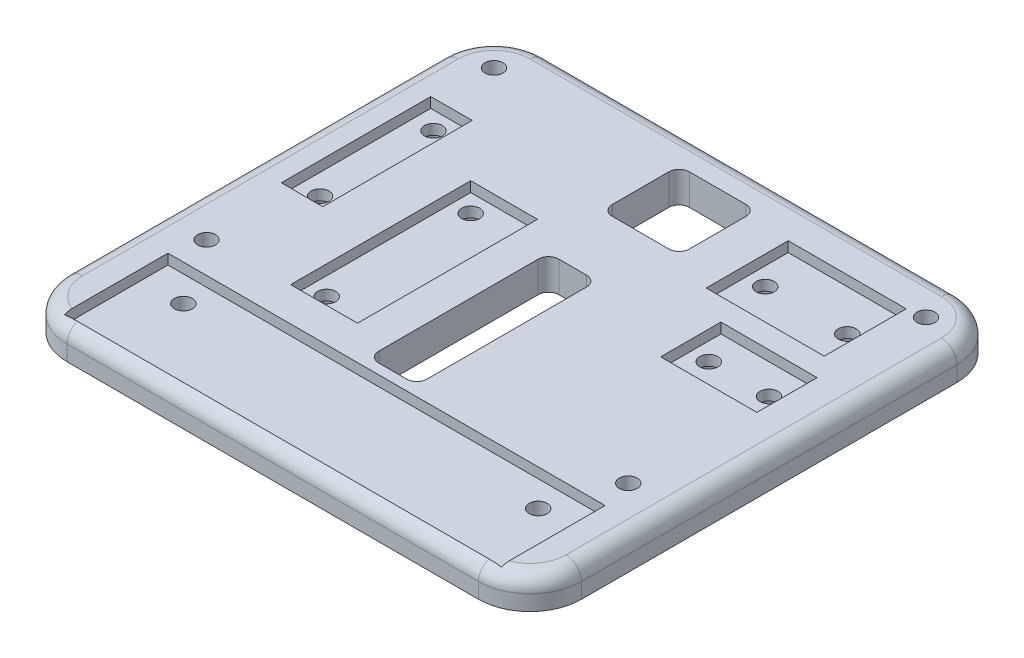
from build123d import *

# Parameters (mm, degrees)
ESBO_O1_W                          = 100
ESBO_O1_H                          = 93
RESSALTO_EXTRUS_O1_DEPTH           = 6
FILETE1_R                          = 10
FILETE2_R                          = 3
ESBO_O2_W                          = 85
ESBO_O2_H                          = 20.1
CORTE_EXTRUS_O1_DEPTH              = 2
CORTE_EXTRUS_O6_REACH              = 70.398
ESBO_O8_R                          = 1.75
ESBO_O5_W                          = 8.05
ESBO_O5_H                          = 29.05
CORTE_EXTRUS_O3_DEPTH              = 2
CORTE_EXTRUS_O10_REACH             = 70.398
ESBO_O13_R                         = 1.75
ESBO_O14_R                         = 3.25
CORTE_EXTRUS_O11_DEPTH             = 2
ESBO_O6_W                          = 22.94
ESBO_O6_H                          = 15.94
CORTE_EXTRUS_O4_DEPTH              = 2
CORTE_EXTRUS_O12_REACH             = 70.398
ESBO_O15_R                         = 1.75
ESBO_O16_R                         = 3.25
CORTE_EXTRUS_O13_DEPTH             = 2
ESBO_O7_W                          = 18.71
ESBO_O7_H                          = 11.71
CORTE_EXTRUS_O5_DEPTH              = 2
CORTE_EXTRUS_O8_REACH              = 70.398
ESBO_O11_R                         = 1.75
ESBO_O12_R                         = 3.25
CORTE_EXTRUS_O9_DEPTH              = 2
ESBO_O17_W                         = 13
ESBO_O17_H                         = 35
CORTE_EXTRUS_O14_DEPTH             = 2
CORTE_EXTRUS_O15_REACH             = 70.398
ESBO_O18_R                         = 1.75
CORTE_EXTRUS_O15_DIRECTION_2_DEPTH = 69.397734022
ESBO_O19_R                         = 3.25
CORTE_EXTRUS_O18_DEPTH             = 2
CORTE_EXTRUS_O17_REACH             = 70.544
ESBO_O20_W                         = 9.4
ESBO_O20_H                         = 35
CORTE_EXTRUS_O19_REACH             = 70.544
ESBO_O21_W                         = 15
ESBO_O21_H                         = 15
FILETE3_R                          = 2
CORTE_EXTRUS_O20_REACH             = 70.544
ESBO_O22_R                         = 1.75
CORTE_EXTRUS_O21_REACH             = 70.544
ESBO_O23_R                         = 1.75


with BuildPart() as part:
    # Esboço1 → Ressalto-extrusão1 (new body)
    with BuildSketch(Plane(origin=(0, 0, 0), x_dir=(1, 0, 0), z_dir=(0, 1, 0))):
        Rectangle(ESBO_O1_W, ESBO_O1_H)
    extrude(amount=RESSALTO_EXTRUS_O1_DEPTH)

    # Filete1
    filete1_edges = [part.edges().sort_by_distance(p)[0] for p in [
        (50, 3, 46.5),
        (-50, 3, 46.5),
        (-50, 3, -46.5),
        (50, 3, -46.5),
    ]]
    fillet(filete1_edges, radius=FILETE1_R)

    # Filete2
    filete2_edges = [part.edges().sort_by_distance(p)[0] for p in [
        (0, 6, -46.5),
        (50, 6, 0),
        (-50, 6, 0),
        (0, 6, 46.5),
        (-47.071067812, 6, -43.571067812),
        (-47.071067812, 6, 43.571067812),
        (47.071067812, 6, 43.571067812),
        (47.071067812, 6, -43.571067812),
    ]]
    fillet(filete2_edges, radius=FILETE2_R)

    # Esboço2 → Corte-extrusão1 (cut)
    with BuildSketch(Plane(origin=(0, 6, 0), x_dir=(1, 0, 0), z_dir=(0, 1, 0))):
        with Locations((0, -34.45)):
            Rectangle(ESBO_O2_W, ESBO_O2_H)
    extrude(amount=-CORTE_EXTRUS_O1_DEPTH, mode=Mode.SUBTRACT)

    # Esboço8 → Corte-extrusão6 (cut, up to next)
    with BuildSketch(Plane(origin=(0, 4, 0), x_dir=(1, 0, 0), z_dir=(0, 1, 0)), mode=Mode.PRIVATE) as corte_extrus_o6_sk1:
        with Locations(Location((34.5, -29.4, 0), (0, 0, 270))):
            Circle(ESBO_O8_R)
    corte_extrus_o6_tool1 = extrude(corte_extrus_o6_sk1.sketch, amount=-CORTE_EXTRUS_O6_REACH, mode=Mode.PRIVATE) & part.part
    # Esboço8 → Corte-extrusão6 (cut, up to next)
    with BuildSketch(Plane(origin=(0, 4, 0), x_dir=(1, 0, 0), z_dir=(0, 1, 0)), mode=Mode.PRIVATE) as corte_extrus_o6_sk2:
        with Locations(Location((-34.5, -29.4, 0), (0, 0, 270))):
            Circle(ESBO_O8_R)
    corte_extrus_o6_tool2 = extrude(corte_extrus_o6_sk2.sketch, amount=-CORTE_EXTRUS_O6_REACH, mode=Mode.PRIVATE) & part.part
    add(corte_extrus_o6_tool1.solids().sort_by_distance((34.5, 4, 29.4))[0], mode=Mode.SUBTRACT)
    add(corte_extrus_o6_tool2.solids().sort_by_distance((-34.5, 4, 29.4))[0], mode=Mode.SUBTRACT)

    # Esboço5 → Corte-extrusão3 (cut)
    with BuildSketch(Plane(origin=(0, 6, 0), x_dir=(1, 0, 0), z_dir=(0, 1, 0))):
        with Locations((-39.3, 13)):
            Rectangle(ESBO_O5_W, ESBO_O5_H)
    extrude(amount=-CORTE_EXTRUS_O3_DEPTH, mode=Mode.SUBTRACT)

    # Esboço13 → Corte-extrusão10 (cut, up to next)
    with BuildSketch(Plane(origin=(0, 4, 0), x_dir=(1, 0, 0), z_dir=(0, 1, 0)), mode=Mode.PRIVATE) as corte_extrus_o10_sk1:
        with Locations(Location((-39.3, 24.025, 0), (0, 0, 270))):
            Circle(ESBO_O13_R)
    corte_extrus_o10_tool1 = extrude(corte_extrus_o10_sk1.sketch, amount=-CORTE_EXTRUS_O10_REACH, mode=Mode.PRIVATE) & part.part
    # Esboço13 → Corte-extrusão10 (cut, up to next)
    with BuildSketch(Plane(origin=(0, 4, 0), x_dir=(1, 0, 0), z_dir=(0, 1, 0)), mode=Mode.PRIVATE) as corte_extrus_o10_sk2:
        with Locations(Location((-39.3, 1.975, 0), (0, 0, 270))):
            Circle(ESBO_O13_R)
    corte_extrus_o10_tool2 = extrude(corte_extrus_o10_sk2.sketch, amount=-CORTE_EXTRUS_O10_REACH, mode=Mode.PRIVATE) & part.part
    add(corte_extrus_o10_tool1.solids().sort_by_distance((-39.3, 4, -24.025))[0], mode=Mode.SUBTRACT)
    add(corte_extrus_o10_tool2.solids().sort_by_distance((-39.3, 4, -1.975))[0], mode=Mode.SUBTRACT)

    # Esboço14 → Corte-extrusão11 (cut)
    with BuildSketch(Plane.XZ):
        with Locations(Location((-39.3, -1.975, 0), (0, 0, 270))):
            Circle(ESBO_O14_R)
        with Locations(Location((-39.3, -24.025, 0), (0, 0, 270))):
            Circle(ESBO_O14_R)
    extrude(amount=-CORTE_EXTRUS_O11_DEPTH, mode=Mode.SUBTRACT)

    # Esboço6 → Corte-extrusão4 (cut)
    with BuildSketch(Plane(origin=(0, 6, 0), x_dir=(1, 0, 0), z_dir=(0, 1, 0))):
        with Locations((27.18, 30.03)):
            Rectangle(ESBO_O6_W, ESBO_O6_H)
    extrude(amount=-CORTE_EXTRUS_O4_DEPTH, mode=Mode.SUBTRACT)

    # Esboço15 → Corte-extrusão12 (cut, up to next)
    with BuildSketch(Plane(origin=(0, 4, 0), x_dir=(1, 0, 0), z_dir=(0, 1, 0)), mode=Mode.PRIVATE) as corte_extrus_o12_sk1:
        with Locations(Location((19.21, 30.03, 0), (0, 0, 270))):
            Circle(ESBO_O15_R)
    corte_extrus_o12_tool1 = extrude(corte_extrus_o12_sk1.sketch, amount=-CORTE_EXTRUS_O12_REACH, mode=Mode.PRIVATE) & part.part
    # Esboço15 → Corte-extrusão12 (cut, up to next)
    with BuildSketch(Plane(origin=(0, 4, 0), x_dir=(1, 0, 0), z_dir=(0, 1, 0)), mode=Mode.PRIVATE) as corte_extrus_o12_sk2:
        with Locations(Location((35.15, 30.03, 0), (0, 0, 270))):
            Circle(ESBO_O15_R)
    corte_extrus_o12_tool2 = extrude(corte_extrus_o12_sk2.sketch, amount=-CORTE_EXTRUS_O12_REACH, mode=Mode.PRIVATE) & part.part
    add(corte_extrus_o12_tool1.solids().sort_by_distance((19.21, 4, -30.03))[0], mode=Mode.SUBTRACT)
    add(corte_extrus_o12_tool2.solids().sort_by_distance((35.15, 4, -30.03))[0], mode=Mode.SUBTRACT)

    # Esboço16 → Corte-extrusão13 (cut)
    with BuildSketch(Plane.XZ):
        with Locations(Location((19.21, -30.03, 0), (0, 0, 270))):
            Circle(ESBO_O16_R)
        with Locations(Location((35.15, -30.03, 0), (0, 0, 270))):
            Circle(ESBO_O16_R)
    extrude(amount=-CORTE_EXTRUS_O13_DEPTH, mode=Mode.SUBTRACT)

    # Esboço7 → Corte-extrusão5 (cut)
    with BuildSketch(Plane(origin=(0, 6, 0), x_dir=(1, 0, 0), z_dir=(0, 1, 0))):
        with Locations((32.22, 11.9)):
            Rectangle(ESBO_O7_W, ESBO_O7_H)
    extrude(amount=-CORTE_EXTRUS_O5_DEPTH, mode=Mode.SUBTRACT)

    # Esboço11 → Corte-extrusão8 (cut, up to next)
    with BuildSketch(Plane(origin=(0, 4, 0), x_dir=(1, 0, 0), z_dir=(0, 1, 0)), mode=Mode.PRIVATE) as corte_extrus_o8_sk1:
        with Locations(Location((26.365, 11.9, 0), (0, 0, 270))):
            Circle(ESBO_O11_R)
    corte_extrus_o8_tool1 = extrude(corte_extrus_o8_sk1.sketch, amount=-CORTE_EXTRUS_O8_REACH, mode=Mode.PRIVATE) & part.part
    # Esboço11 → Corte-extrusão8 (cut, up to next)
    with BuildSketch(Plane(origin=(0, 4, 0), x_dir=(1, 0, 0), z_dir=(0, 1, 0)), mode=Mode.PRIVATE) as corte_extrus_o8_sk2:
        with Locations(Location((38.075, 11.9, 0), (0, 0, 270))):
            Circle(ESBO_O11_R)
    corte_extrus_o8_tool2 = extrude(corte_extrus_o8_sk2.sketch, amount=-CORTE_EXTRUS_O8_REACH, mode=Mode.PRIVATE) & part.part
    add(corte_extrus_o8_tool1.solids().sort_by_distance((26.365, 4, -11.9))[0], mode=Mode.SUBTRACT)
    add(corte_extrus_o8_tool2.solids().sort_by_distance((38.075, 4, -11.9))[0], mode=Mode.SUBTRACT)

    # Esboço12 → Corte-extrusão9 (cut)
    with BuildSketch(Plane.XZ):
        with Locations(Location((26.365, -11.9, 0), (0, 0, 270))):
            Circle(ESBO_O12_R)
        with Locations(Location((38.075, -11.9, 0), (0, 0, 270))):
            Circle(ESBO_O12_R)
    extrude(amount=-CORTE_EXTRUS_O9_DEPTH, mode=Mode.SUBTRACT)

    # Esboço17 → Corte-extrusão14 (cut)
    with BuildSketch(Plane(origin=(0, 6, 0), x_dir=(1, 0, 0), z_dir=(0, 1, 0))):
        with Locations((-18.77, -0.27)):
            Rectangle(ESBO_O17_W, ESBO_O17_H)
    extrude(amount=-CORTE_EXTRUS_O14_DEPTH, mode=Mode.SUBTRACT)

    # Esboço18 → Corte-extrusão15 (cut, up to next)
    with BuildSketch(Plane(origin=(0, 4, 0), x_dir=(1, 0, 0), z_dir=(0, 1, 0)), mode=Mode.PRIVATE) as corte_extrus_o15_sk1:
        with Locations(Location((-21.77, 13.73, 0), (0, 0, 90))):
            Circle(ESBO_O18_R)
    corte_extrus_o15_tool1 = extrude(corte_extrus_o15_sk1.sketch, amount=-CORTE_EXTRUS_O15_REACH, mode=Mode.PRIVATE) & part.part
    # Esboço18 → Corte-extrusão15 (cut, up to next)
    with BuildSketch(Plane(origin=(0, 4, 0), x_dir=(1, 0, 0), z_dir=(0, 1, 0)), mode=Mode.PRIVATE) as corte_extrus_o15_sk2:
        with Locations(Location((-21.77, -14.27, 0), (0, 0, 90))):
            Circle(ESBO_O18_R)
    corte_extrus_o15_tool2 = extrude(corte_extrus_o15_sk2.sketch, amount=-CORTE_EXTRUS_O15_REACH, mode=Mode.PRIVATE) & part.part
    add(corte_extrus_o15_tool1.solids().sort_by_distance((-21.77, 4, -13.73))[0], mode=Mode.SUBTRACT)
    add(corte_extrus_o15_tool2.solids().sort_by_distance((-21.77, 4, 14.27))[0], mode=Mode.SUBTRACT)

    # Esboço18 → Corte-extrusão15 direction 2 (cut)
    with BuildSketch(Plane(origin=(0, 4, 0), x_dir=(1, 0, 0), z_dir=(0, 1, 0))):
        with Locations(Location((-21.77, 13.73, 0), (0, 0, 90))):
            Circle(ESBO_O18_R)
        with Locations(Location((-21.77, -14.27, 0), (0, 0, 90))):
            Circle(ESBO_O18_R)
    extrude(amount=CORTE_EXTRUS_O15_DIRECTION_2_DEPTH, mode=Mode.SUBTRACT)

    # Esboço19 → Corte-extrusão18 (cut)
    with BuildSketch(Plane.XZ):
        with Locations(Location((-21.77, 14.27, 0), (0, 0, 270))):
            Circle(ESBO_O19_R)
        with Locations(Location((-21.77, -13.73, 0), (0, 0, 270))):
            Circle(ESBO_O19_R)
    extrude(amount=-CORTE_EXTRUS_O18_DEPTH, mode=Mode.SUBTRACT)

    # Esboço20 → Corte-extrusão17 (cut, up to next)
    with BuildSketch(Plane(origin=(0, 6, 0), x_dir=(1, 0, 0), z_dir=(0, 1, 0)), mode=Mode.PRIVATE) as corte_extrus_o17_sk1:
        with Locations((-0.8, -4.9)):
            Rectangle(ESBO_O20_W, ESBO_O20_H)
    corte_extrus_o17_tool1 = extrude(corte_extrus_o17_sk1.sketch, amount=-CORTE_EXTRUS_O17_REACH, mode=Mode.PRIVATE) & part.part
    add(corte_extrus_o17_tool1.solids().sort_by_distance((-0.8, 6, 4.9))[0], mode=Mode.SUBTRACT)

    # Esboço21 → Corte-extrusão19 (cut, up to next)
    with BuildSketch(Plane(origin=(0, 6, 0), x_dir=(1, 0, 0), z_dir=(0, 1, 0)), mode=Mode.PRIVATE) as corte_extrus_o19_sk1:
        with Locations((0, 32.5)):
            Rectangle(ESBO_O21_W, ESBO_O21_H)
    corte_extrus_o19_tool1 = extrude(corte_extrus_o19_sk1.sketch, amount=-CORTE_EXTRUS_O19_REACH, mode=Mode.PRIVATE) & part.part
    add(corte_extrus_o19_tool1.solids().sort_by_distance((0, 6, -32.5))[0], mode=Mode.SUBTRACT)

    # Filete3
    filete3_edges = [part.edges().sort_by_distance(p)[0] for p in [
        (-5.5, 3, 22.4),
        (-5.5, 3, -12.6),
        (3.9, 3, -12.6),
        (3.9, 3, 22.4),
        (-7.5, 3, -25),
        (-7.5, 3, -40),
        (7.5, 3, -40),
        (7.5, 3, -25),
    ]]
    fillet(filete3_edges, radius=FILETE3_R)

    # Esboço22 → Corte-extrusão20 (cut, up to next)
    with BuildSketch(Plane(origin=(0, 6, 0), x_dir=(1, 0, 0), z_dir=(0, 1, 0)), mode=Mode.PRIVATE) as corte_extrus_o20_sk1:
        with Locations(Location((41, -18.4, 0), (0, 0, 270))):
            Circle(ESBO_O22_R)
    corte_extrus_o20_tool1 = extrude(corte_extrus_o20_sk1.sketch, amount=-CORTE_EXTRUS_O20_REACH, mode=Mode.PRIVATE) & part.part
    corte_extrus_o20 = corte_extrus_o20_tool1.solids().sort_by_distance((41, 6, 18.4))[0]
    add(corte_extrus_o20, mode=Mode.SUBTRACT)

    # Esboço23 → Corte-extrusão21 (cut, up to next)
    with BuildSketch(Plane(origin=(0, 6, 0), x_dir=(1, 0, 0), z_dir=(0, 1, 0)), mode=Mode.PRIVATE) as corte_extrus_o21_sk1:
        with Locations(Location((42, 38.5, 0), (0, 0, 270))):
            Circle(ESBO_O23_R)
    corte_extrus_o21_tool1 = extrude(corte_extrus_o21_sk1.sketch, amount=-CORTE_EXTRUS_O21_REACH, mode=Mode.PRIVATE) & part.part
    corte_extrus_o21 = corte_extrus_o21_tool1.solids().sort_by_distance((42, 6, -38.5))[0]
    add(corte_extrus_o21, mode=Mode.SUBTRACT)

    # Espelhar1: Corte-extrusão20, Corte-extrusão21 across plane
    add(corte_extrus_o20.mirror(Plane(origin=(0, 0, 0), x_dir=(0, 0, 1), z_dir=(1, 0, 0))), mode=Mode.SUBTRACT)
    add(corte_extrus_o21.mirror(Plane(origin=(0, 0, 0), x_dir=(0, 0, 1), z_dir=(1, 0, 0))), mode=Mode.SUBTRACT)


solid = part.part
